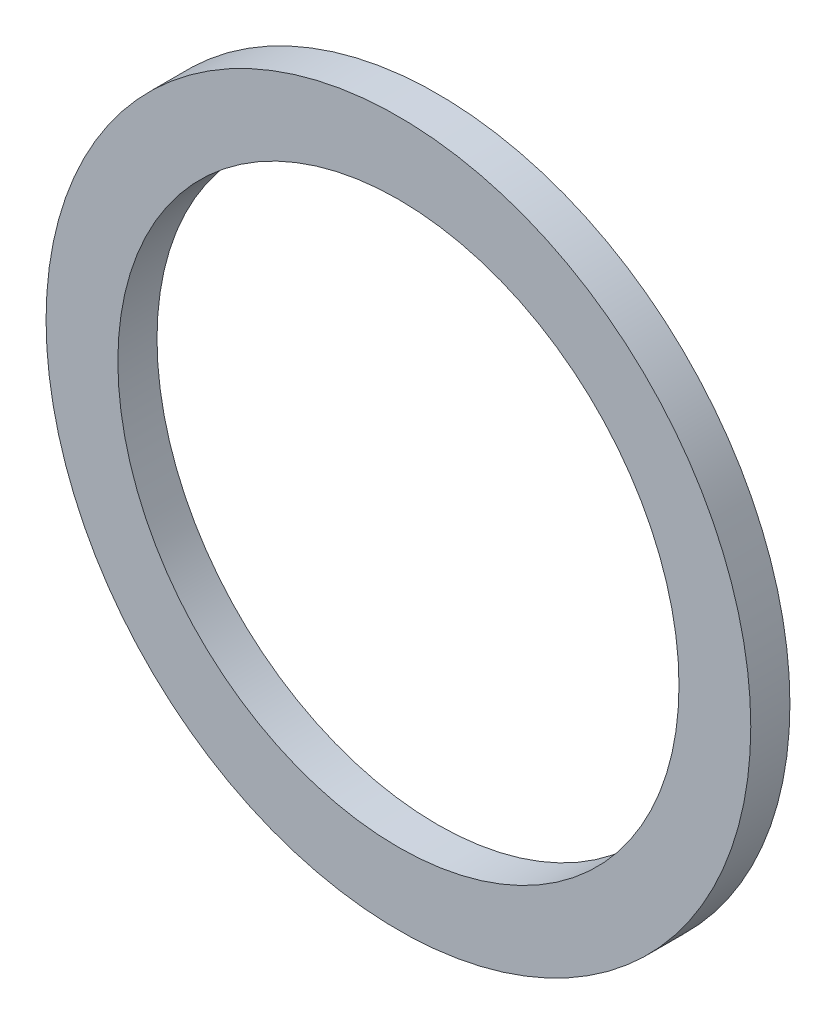
from build123d import *

# Parameters (mm, degrees)
ESQUISSE1_R          = 13.5
ESQUISSE1_R_2        = 10.75
BASE_EXTRUSION_DEPTH = 1.5


with BuildPart() as part:
    # Esquisse1 → Base-Extrusion (new body)
    with BuildSketch(Plane.XY):
        Circle(ESQUISSE1_R)
        Circle(ESQUISSE1_R_2, mode=Mode.SUBTRACT)
    extrude(amount=BASE_EXTRUSION_DEPTH)


solid = part.part
